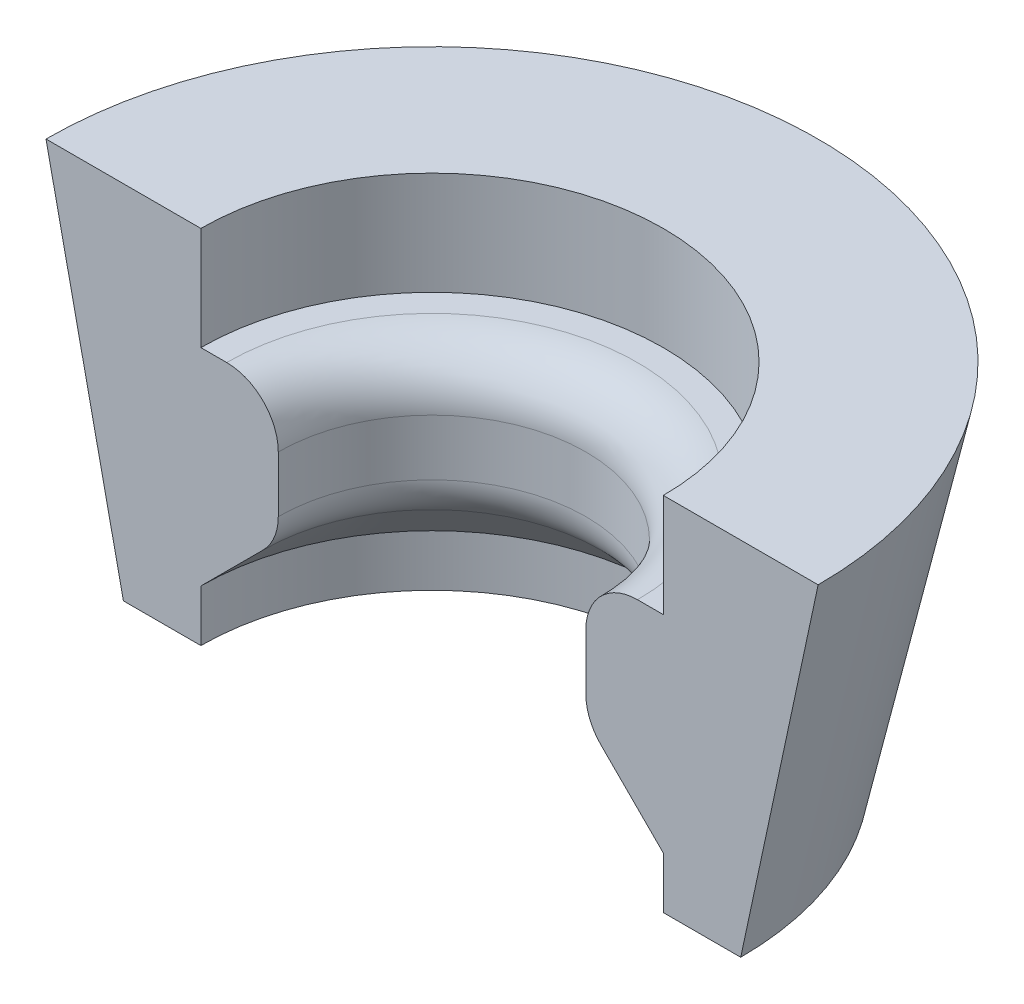
from build123d import *

# Parameters (mm, degrees)
REVOLVE1_ANGLE = 180


with BuildPart() as part:
    # Sketch1 → Revolve1 (revolve)
    with BuildSketch(Plane.XY):
        with BuildLine():
            Line((-3.556, 1.5875), (-3.556, 3.175))
            Line((-3.556, 3.175), (-5.93725, 3.175))
            Line((-5.93725, 3.175), (-4.746625, -2.38125))
            Line((-4.746625, -2.38125), (-3.556, -2.38125))
            Line((-3.556, -2.38125), (-3.556, -1.5875))
            Line((-3.556, -1.5875), (-2.597858992, -0.629358992))
            ThreePointArc((-2.597858992, -0.629358992), (-2.425795621, -0.371847959), (-2.365375, -0.068092985))
            Line((-2.365375, -0.068092985), (-2.365375, 0.79375))
            ThreePointArc((-2.365375, 0.79375), (-2.597858992, 1.355016008), (-3.159125, 1.5875))
            Line((-3.159125, 1.5875), (-3.556, 1.5875))
        make_face()
    revolve(axis=Axis((0, 1.5875, 0), (0, -1, 0)), revolution_arc=REVOLVE1_ANGLE)


solid = part.part
